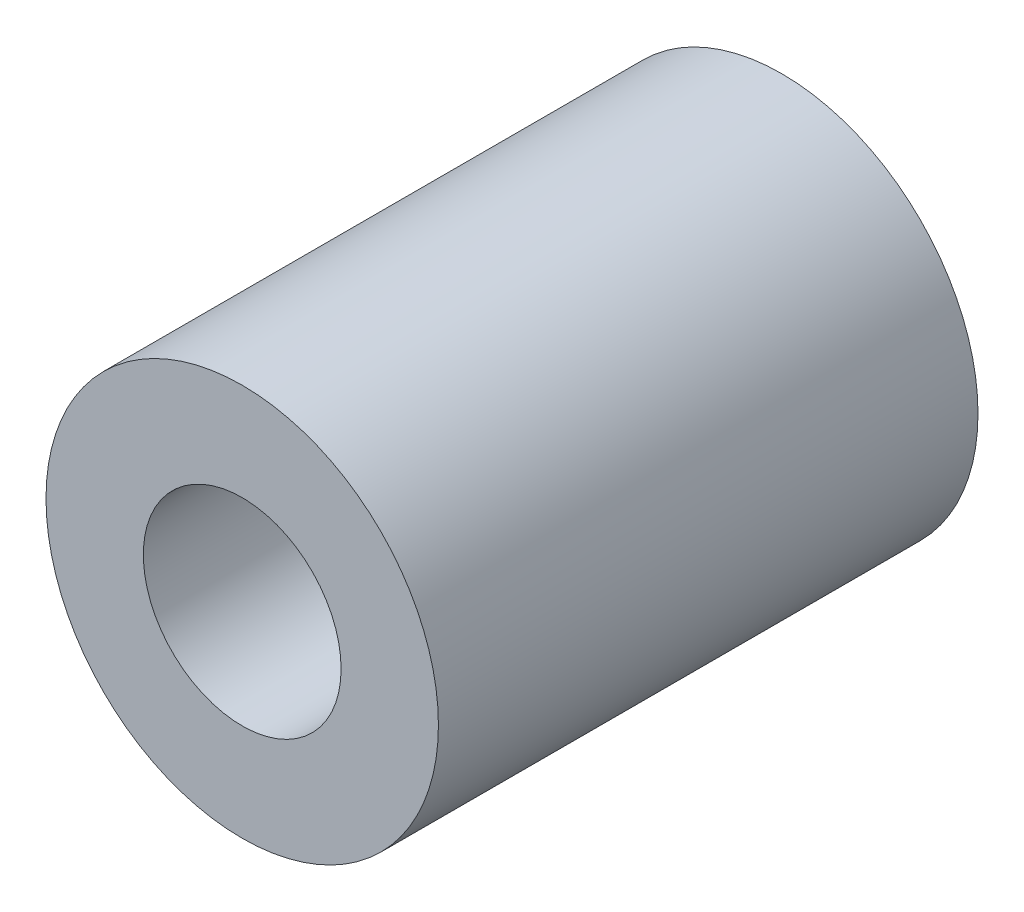
from build123d import *

# Parameters (mm, degrees)
SKETCH1_R      = 6.35
SKETCH1_R_2    = 3.2004
EXTRUDE1_DEPTH = 8.73125


with BuildPart() as part:
    # Sketch1 → Extrude1 (new, symmetric)
    with BuildSketch(Plane.XY):
        Circle(SKETCH1_R)
        Circle(SKETCH1_R_2, mode=Mode.SUBTRACT)
    extrude(amount=EXTRUDE1_DEPTH, both=True)


solid = part.part
